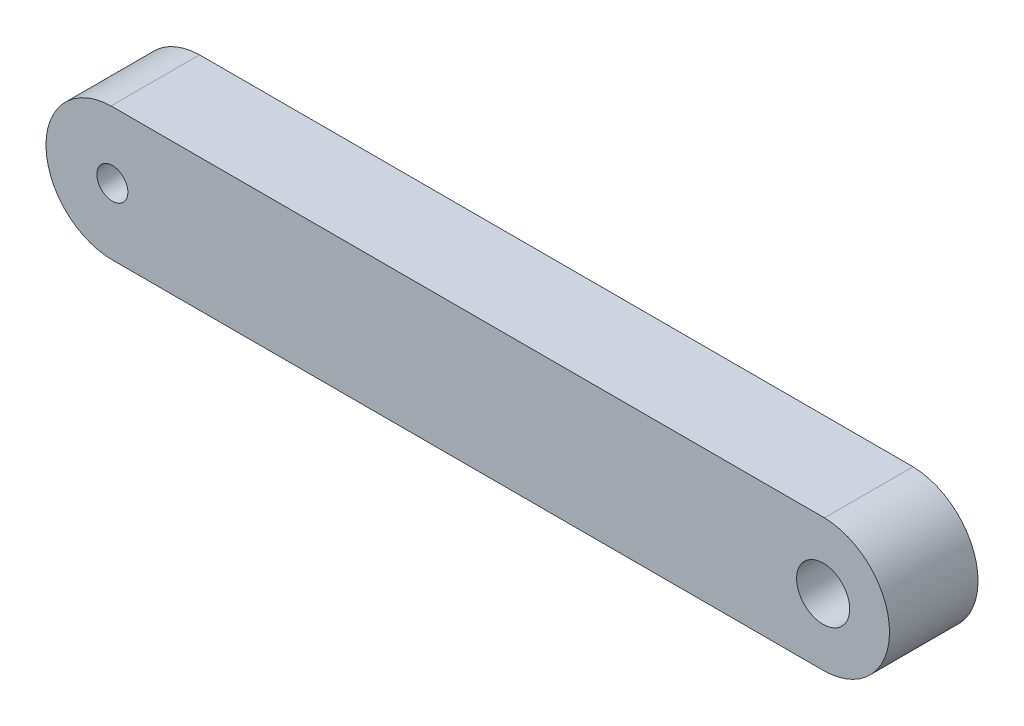
from build123d import *

# Parameters (mm, degrees)
SKETCH_1_R      = 1.75
SKETCH_1_R_2    = 3
EXTRUDE_2_DEPTH = 10


with BuildPart() as part:
    # 草图1 → 凸台-拉伸2 (new body)
    # profile 1 of 3: a face of its own
    with BuildSketch(Plane.XY):
        with BuildLine():
            Line((-46.972427161, 9.823182252), (-47.276428481, 9.823182252))
            ThreePointArc((-47.276428481, 9.823182252), (-54.622887383, 2.17272203), (-46.972427161, -5.173736872))
            ThreePointArc((-46.972427161, -5.173736872), (-41.767656174, -2.92456274), (-39.624427821, 2.32472269))
            ThreePointArc((-39.624427821, 2.32472269), (-41.767656174, 7.57400812), (-46.972427161, 9.823182252))
        make_face()
        with Locations((-47.124427821, 2.32472269)):
            Circle(SKETCH_1_R, mode=Mode.SUBTRACT)
    # profile 2 of 3: a face of its own
    with BuildSketch(Plane.XY):
        with BuildLine():
            Line((33.027572839, 9.823182252), (-46.972427161, 9.823182252))
            ThreePointArc((-46.972427161, 9.823182252), (-41.767656174, 7.57400812), (-39.624427821, 2.32472269))
            ThreePointArc((-39.624427821, 2.32472269), (-41.767656174, -2.92456274), (-46.972427161, -5.173736872))
            Line((-46.972427161, -5.173736872), (33.027572839, -5.173736872))
            ThreePointArc((33.027572839, -5.173736872), (25.679573499, 2.32472269), (33.027572839, 9.823182252))
        make_face()
    # profile 3 of 3: a face of its own
    with BuildSketch(Plane.XY):
        with BuildLine():
            Line((33.331574159, 9.823182252), (33.027572839, 9.823182252))
            ThreePointArc((33.027572839, 9.823182252), (25.679573499, 2.32472269), (33.027572839, -5.173736872))
            ThreePointArc((33.027572839, -5.173736872), (38.428858929, -3.032048957), (40.679573499, 2.32472269))
            ThreePointArc((40.679573499, 2.32472269), (38.536345146, 7.57400812), (33.331574159, 9.823182252))
        make_face()
        with Locations((33.179573499, 2.32472269)):
            Circle(SKETCH_1_R_2, mode=Mode.SUBTRACT)
    extrude(amount=EXTRUDE_2_DEPTH)


solid = part.part
